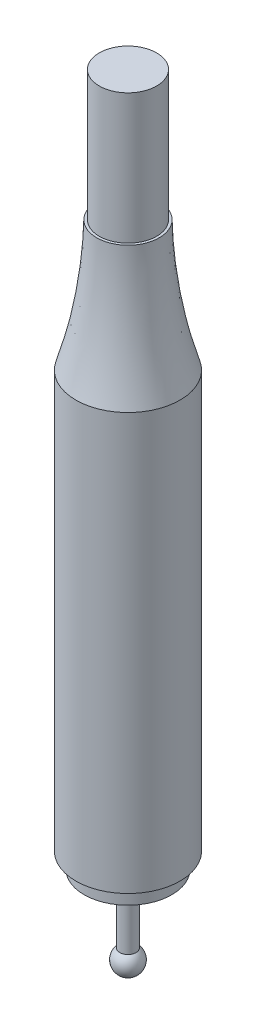
from build123d import *


with BuildPart() as part:
    # Sketch1 → Revolve3 (revolve)
    with BuildSketch(Plane.XY, mode=Mode.PRIVATE) as revolve3_sk:
        with BuildLine():
            Line((12.7, 0), (10.7, 0))
            Line((10.7, 0), (10.7, -3.884392891))
            Line((10.7, -3.884392891), (1.984375, -3.884392891))
            Line((1.984375, -3.884392891), (1.984375, -20.455909311))
            ThreePointArc((1.984375, -20.455909311), (2.995814611, -23.985925019), (0, -26.109392891))
            Line((0, -26.109392891), (0, 165.1))
            Line((0, 165.1), (7, 165.1))
            Line((7, 165.1), (7, 133.35))
            Line((7, 133.35), (7.62, 133.35))
            add(Edge.make_bspline(
                [(12.7, 101.6), (7.965904328, 117.119921913), (7.62, 133.35)],
                knots=[0, 0, 0, 1, 1, 1], degree=2))
            Line((12.7, 101.6), (12.7, 0))
        make_face()
    revolve(revolve3_sk.sketch.rotate(Axis((0, 165.1, 0), (0, -1, 0)), 90), axis=Axis((0, 165.1, 0), (0, -1, 0)))


solid = part.part
